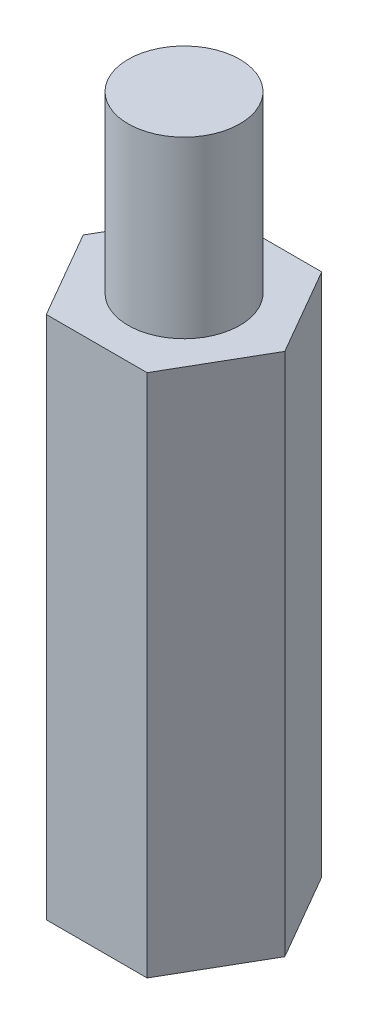
from build123d import *

# Parameters (mm, degrees)
BOSS_EXTRUDE1_DEPTH = 14.3002
SKETCH2_R           = 1.524
BOSS_EXTRUDE2_DEPTH = 4.7625
SKETCH3_R           = 0.79375
CUT_EXTRUDE1_DEPTH  = 4.7625


with BuildPart() as part:
    # Sketch1 → Boss-Extrude1 (new body)
    with BuildSketch(Plane(origin=(0, 0, 0), x_dir=(1, 0, 0), z_dir=(0, 1, 0))):
        Polygon((-1.374815329, 2.38125), (1.374815329, 2.38125), (2.749630657, 0), (1.374815329, -2.38125), (-1.374815329, -2.38125), (-2.749630657, 0), align=None)
    extrude(amount=BOSS_EXTRUDE1_DEPTH)

    # Sketch2 → Boss-Extrude2 (add)
    with BuildSketch(Plane(origin=(0, 14.3002, 0), x_dir=(1, 0, 0), z_dir=(0, 1, 0))):
        with Locations(Location((0, 0, 0), (0, 0, 90))):
            Circle(SKETCH2_R)
    extrude(amount=BOSS_EXTRUDE2_DEPTH)

    # Sketch3 → Cut-Extrude1 (cut)
    with BuildSketch(Plane.XZ):
        with Locations(Location((0, 0, 0), (0, 0, 270))):
            Circle(SKETCH3_R)
    extrude(amount=-CUT_EXTRUDE1_DEPTH, mode=Mode.SUBTRACT)


solid = part.part
